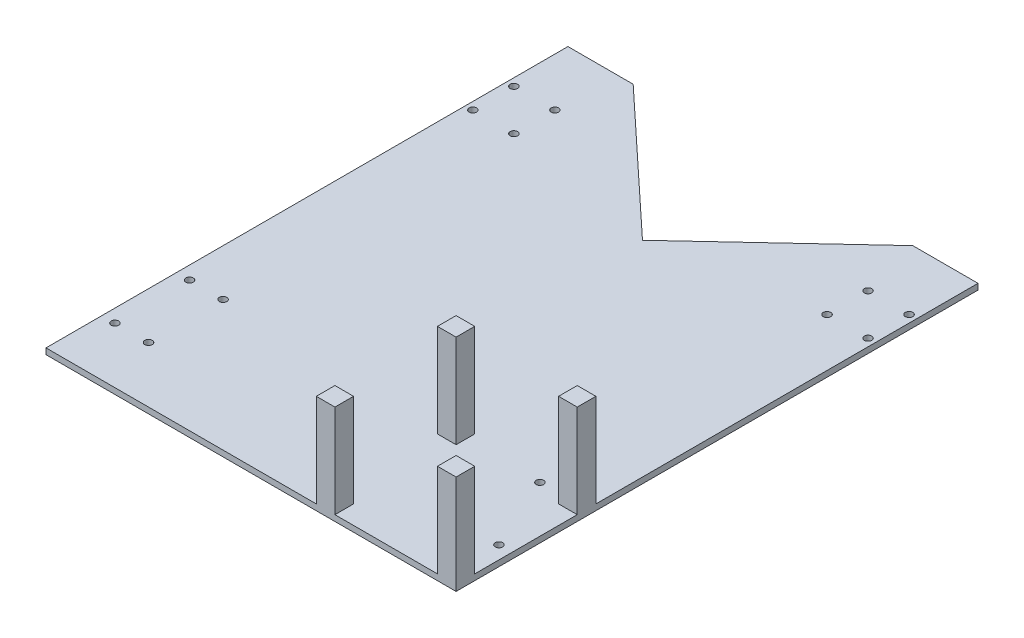
from build123d import *

# Parameters (mm, degrees)
SKETCH3_W           = 220
SKETCH3_H           = 280
BOSS_EXTRUDE1_DEPTH = 3.175
SKETCH4_W           = 10
SKETCH4_H           = 10
BOSS_EXTRUDE2_DEPTH = 50
SKETCH7_R           = 2
SKETCH7_R_2         = 2.000000006
SKETCH7_R_3         = 1.999999994
CUT_EXTRUDE2_DEPTH  = 10
CUT_EXTRUDE4_DEPTH  = 10


with BuildPart() as part:
    # Sketch3 → Boss-Extrude1 (new body)
    with BuildSketch(Plane(origin=(0, 0, 0), x_dir=(1, 0, 0), z_dir=(0, 1, 0))):
        Rectangle(SKETCH3_W, SKETCH3_H)
    extrude(amount=BOSS_EXTRUDE1_DEPTH)

    # Sketch4 → Boss-Extrude2 (add)
    with BuildSketch(Plane(origin=(0, 3.175, 0), x_dir=(1, 0, 0), z_dir=(0, 1, 0))):
        with Locations((105, -135)):
            Rectangle(SKETCH4_W, SKETCH4_H)
        with Locations((105, -70)):
            Rectangle(SKETCH4_W, SKETCH4_H)
        with Locations((40, -135)):
            Rectangle(SKETCH4_W, SKETCH4_H)
        with Locations((40, -70)):
            Rectangle(SKETCH4_W, SKETCH4_H)
    extrude(amount=BOSS_EXTRUDE2_DEPTH)

    # Sketch7 → Cut-Extrude2 (cut)
    with BuildSketch(Plane.XZ):
        with Locations(Location((-103, 70, 0), (0, 0, 270))):
            Circle(SKETCH7_R)
        with Locations(Location((-103, 110, 0), (0, 0, 270))):
            Circle(SKETCH7_R)
        with Locations(Location((-85, 110, 0), (0, 0, 270))):
            Circle(SKETCH7_R_2)
        with Locations(Location((-85, 70, 0), (0, 0, 270))):
            Circle(SKETCH7_R)
        with Locations(Location((85, 110, 0), (0, 0, 270))):
            Circle(SKETCH7_R_3)
        with Locations(Location((103, 110, 0), (0, 0, 270))):
            Circle(SKETCH7_R)
        with Locations(Location((103, 70, 0), (0, 0, 270))):
            Circle(SKETCH7_R)
        with Locations(Location((85, 70, 0), (0, 0, 270))):
            Circle(SKETCH7_R)
        with Locations(Location((106, -107, 0), (0, 0, 270))):
            Circle(SKETCH7_R)
        with Locations(Location((84, -85, 0), (0, 0, 270))):
            Circle(SKETCH7_R)
        with Locations(Location((106, -85, 0), (0, 0, 270))):
            Circle(SKETCH7_R)
        with Locations(Location((84, -107, 0), (0, 0, 270))):
            Circle(SKETCH7_R)
        with Locations(Location((-84, -107, 0), (0, 0, 270))):
            Circle(SKETCH7_R)
        with Locations(Location((-106, -107, 0), (0, 0, 270))):
            Circle(SKETCH7_R)
        with Locations(Location((-106, -85, 0), (0, 0, 270))):
            Circle(SKETCH7_R)
        with Locations(Location((-84, -85, 0), (0, 0, 270))):
            Circle(SKETCH7_R)
    extrude(amount=-CUT_EXTRUDE2_DEPTH, mode=Mode.SUBTRACT)

    # Sketch9 → Cut-Extrude4 (cut)
    with BuildSketch(Plane(origin=(0, 3.175, 0), x_dir=(1, 0, 0), z_dir=(0, 1, 0))):
        Polygon((0, 70), (75, 140), (-75, 140), align=None)
    extrude(amount=-CUT_EXTRUDE4_DEPTH, mode=Mode.SUBTRACT)


solid = part.part
